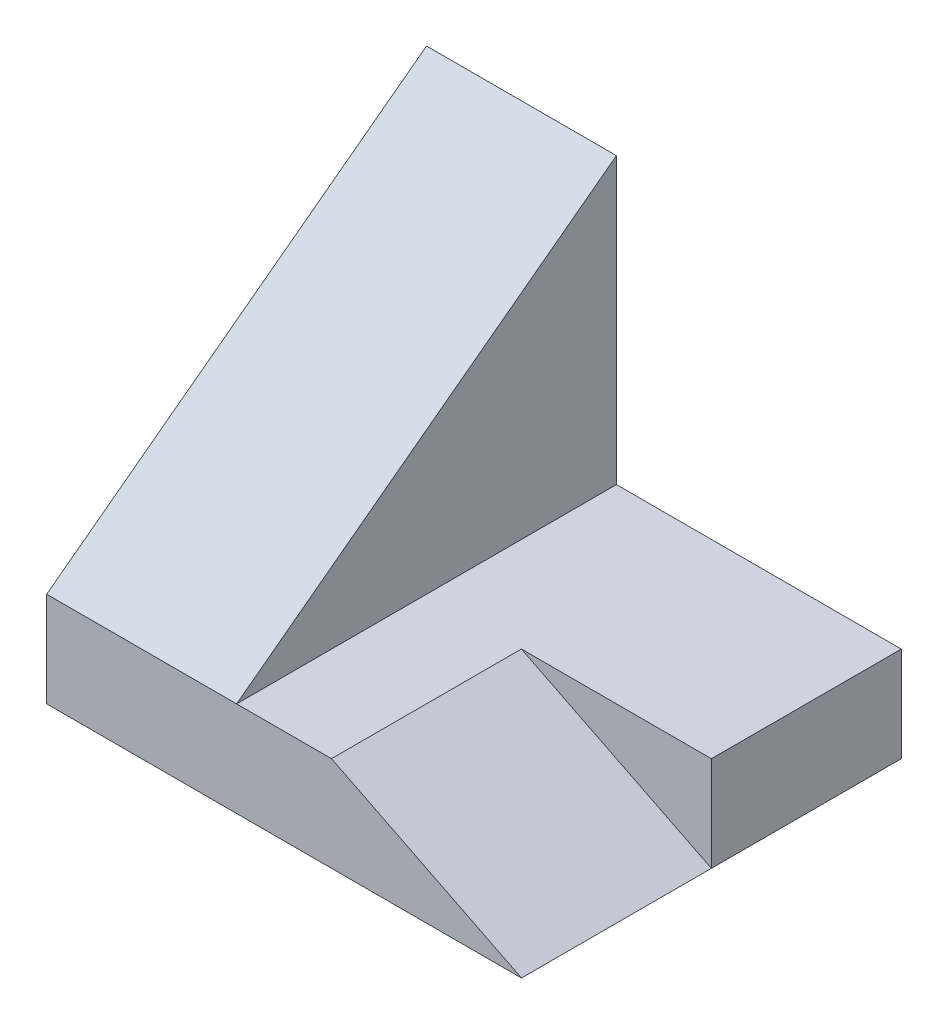
from build123d import *

# Parameters (mm, degrees)
SKETCH16_W          = 50
SKETCH16_H          = 40
BOSS_EXTRUDE3_DEPTH = 10
CUT_EXTRUDE10_DEPTH = 20
SKETCH21_W          = 20.000334642
SKETCH21_H          = 40
BOSS_EXTRUDE4_DEPTH = 30
CUT_EXTRUDE12_DEPTH = 21


with BuildPart() as part:
    # Sketch16 → Boss-Extrude3 (new body)
    with BuildSketch(Plane(origin=(0, 0, 0), x_dir=(1, 0, 0), z_dir=(0, 1, 0))):
        with Locations((25, 20)):
            Rectangle(SKETCH16_W, SKETCH16_H)
    extrude(amount=BOSS_EXTRUDE3_DEPTH)

    # Sketch20 → Cut-Extrude10 (cut)
    with BuildSketch(Plane.XY):
        Polygon((50, 10), (29.992004992, 10), (50, 0), align=None)
    extrude(amount=-CUT_EXTRUDE10_DEPTH, mode=Mode.SUBTRACT)

    # Sketch21 → Boss-Extrude4 (add)
    with BuildSketch(Plane(origin=(0, 10, 0), x_dir=(1, 0, 0), z_dir=(0, 1, 0))):
        with Locations((10.000167321, 20)):
            Rectangle(SKETCH21_W, SKETCH21_H)
    extrude(amount=BOSS_EXTRUDE4_DEPTH)

    # Sketch22 → Cut-Extrude12 (cut)
    with BuildSketch(Plane(origin=(20.000334642, 0, 0), x_dir=(0, 0, -1), z_dir=(1, 0, 0))):
        Polygon((40, 40), (0, 40), (0, 10), align=None)
    extrude(amount=-CUT_EXTRUDE12_DEPTH, mode=Mode.SUBTRACT)


solid = part.part
